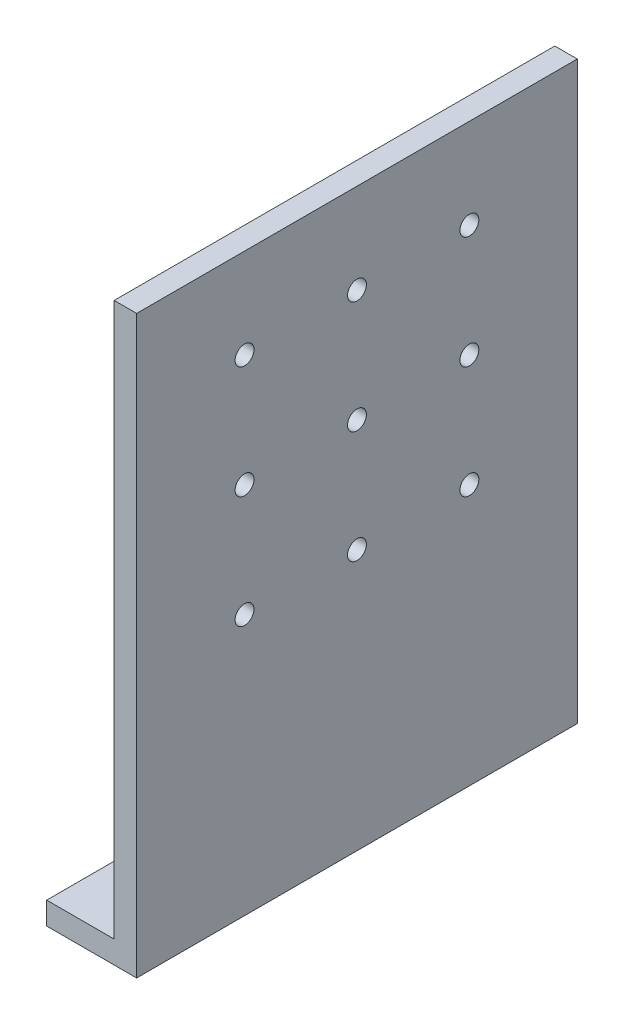
from build123d import *

# Parameters (mm, degrees)
EXTRUDE_1_DEPTH        = 98
HOLE_WIZARD_M5_1_D     = 4.2
HOLE_WIZARD_M5_1_DEPTH = 14
HOLE_WIZARD_M5_1_TIP   = 1.2618073
HOLE_WIZARD_M5_2_D     = 4.2
HOLE_WIZARD_M5_2_DEPTH = 14
HOLE_WIZARD_M5_2_TIP   = 1.2618073


with BuildPart() as part:
    # 草图1 → 凸台-拉伸1 (new body)
    with BuildSketch(Plane.XY):
        Polygon((0, 0), (0, 128), (-5, 128), (-5, 5), (-20, 5), (-20, 0), align=None)
    extrude(amount=EXTRUDE_1_DEPTH)

    # M5 螺纹孔1
    with Locations(Plane(origin=(0, 5, 0), x_dir=(1, 0, 0), z_dir=(0, 1, 0))):
        with Locations((-12.5, -24), (-12.5, -74)):
            Hole(HOLE_WIZARD_M5_1_D / 2, depth=HOLE_WIZARD_M5_1_DEPTH)
            with Locations((0, 0, -(HOLE_WIZARD_M5_1_DEPTH + HOLE_WIZARD_M5_1_TIP / 2))):  # 118° drill point
                Cone(0, HOLE_WIZARD_M5_1_D / 2, HOLE_WIZARD_M5_1_TIP, mode=Mode.SUBTRACT)

    # M5 螺纹孔2
    with Locations(Plane.ZY.offset(5)):
        with Locations((24, 58), (49, 58), (74, 58), (74, 83), (74, 108), (49, 108), (24, 108), (24, 83), (49, 83)):
            Hole(HOLE_WIZARD_M5_2_D / 2, depth=HOLE_WIZARD_M5_2_DEPTH)
            with Locations((0, 0, -(HOLE_WIZARD_M5_2_DEPTH + HOLE_WIZARD_M5_2_TIP / 2))):  # 118° drill point
                Cone(0, HOLE_WIZARD_M5_2_D / 2, HOLE_WIZARD_M5_2_TIP, mode=Mode.SUBTRACT)


solid = part.part
